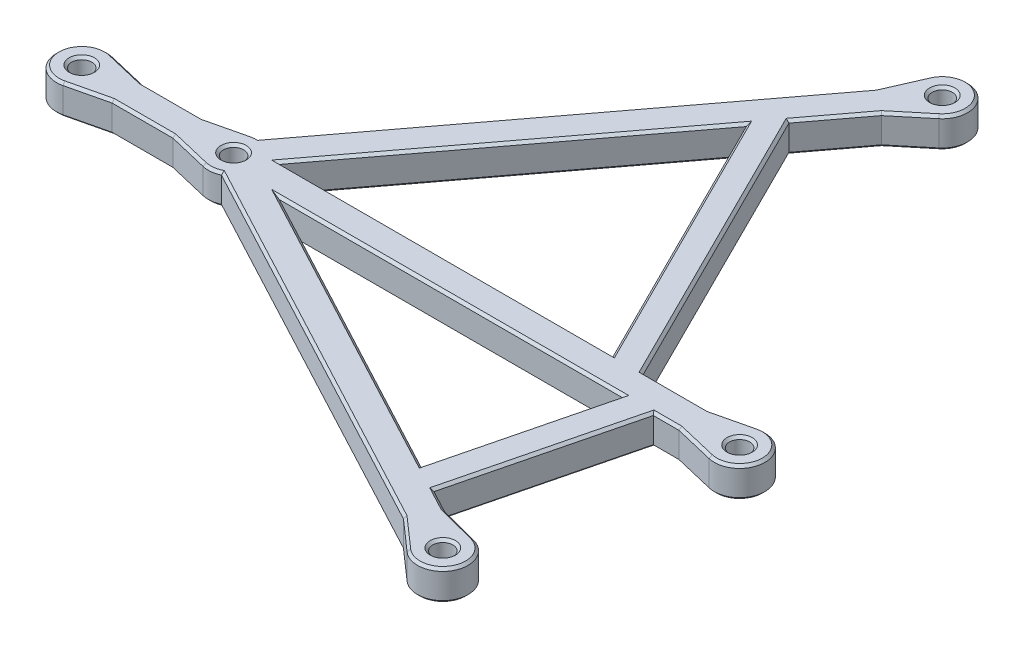
from build123d import *

# Parameters (mm, degrees)
SKETCH_1_R      = 1
EXTRUDE_2_DEPTH = 3
SKETCH_3_R      = 1
EXTRUDE_3_DEPTH = 3
EXTRUDE_4_DEPTH = 3
EXTRUDE_5_DEPTH = 3
EXTRUDE_6_DEPTH = 3
CHAMFER_1_SIZE  = 0.25


with BuildPart() as part:
    # 草图1 → 凸台-拉伸2 (new body)
    with BuildSketch(Plane(origin=(0, 0, 0), x_dir=(1, 0, 0), z_dir=(0, 1, 0))):
        with BuildLine():
            Line((2, 1.5), (13, 1.5))
            ThreePointArc((13, 1.5), (15, 2.5), (17, 1.5))
            Line((17, 1.5), (63, 1.5))
            ThreePointArc((63, 1.5), (67.5, 0), (63, -1.5))
            Line((63, -1.5), (17, -1.5))
            ThreePointArc((17, -1.5), (15, -2.5), (13, -1.5))
            Line((13, -1.5), (2, -1.5))
            ThreePointArc((2, -1.5), (-2.5, 0), (2, 1.5))
        make_face()
        with Locations(Location((0, 0, 0), (0, 0, 270))):
            Circle(SKETCH_1_R, mode=Mode.SUBTRACT)
        with Locations(Location((15, 0, 0), (0, 0, 270))):
            Circle(SKETCH_1_R, mode=Mode.SUBTRACT)
        with Locations(Location((65, 0, 0), (0, 0, 270))):
            Circle(SKETCH_1_R, mode=Mode.SUBTRACT)
    extrude(amount=EXTRUDE_2_DEPTH)

    # 草图3 → 凸台-拉伸3 (add)
    with BuildSketch(Plane(origin=(0, 0, 0), x_dir=(1, 0, 0), z_dir=(0, 1, 0))):
        with BuildLine():
            Line((15.005676781, 2.499993555), (42.689167846, 39.237227017))
            ThreePointArc((42.689167846, 39.237227017), (46.595288715, 41.928364277), (45.085074376, 37.431781948))
            Line((45.085074376, 37.431781948), (17.401583311, 0.694548485))
            ThreePointArc((17.401583311, 0.694548485), (17.440740018, 0.541099035), (17.47010253, 0.385478264))
            Line((17.47010253, 0.385478264), (58.085691801, -21.210213624))
            ThreePointArc((58.085691801, -21.210213624), (61.354748625, -24.647257046), (56.677277113, -23.859056403))
            Line((56.677277113, -23.859056403), (16.061687842, -2.263364515))
            ThreePointArc((16.061687842, -2.263364515), (12.559259982, -0.541099035), (15.005676781, 2.499993555))
        make_face()
        with Locations(Location((59.147379643, -23.473578139, 0), (0, 0, 270))):
            Circle(SKETCH_3_R, mode=Mode.SUBTRACT)
        with Locations(Location((45.090751158, 39.931775502, 0), (0, 0, 270))):
            Circle(SKETCH_3_R, mode=Mode.SUBTRACT)
        with Locations(Location((15, 0, 0), (0, 0, 270))):
            Circle(SKETCH_3_R, mode=Mode.SUBTRACT)
    extrude(amount=EXTRUDE_3_DEPTH)

    # 草图5 → 凸台-拉伸4 (add)
    with BuildSketch(Plane(origin=(0, 0, 0), x_dir=(1, 0, 0), z_dir=(0, 1, 0))):
        Polygon((50.968736425, 1.5), (37.844479209, 27.823187626), (39.651372694, 30.221016268), (53.97114317, 1.5), align=None)
    extrude(amount=EXTRUDE_4_DEPTH)

    # 草图6 → 凸台-拉伸5 (add)
    with BuildSketch(Plane(origin=(0, 0, 0), x_dir=(1, 0, 0), z_dir=(0, 1, 0))):
        Polygon((54.971865105, -1.5), (50.997269421, -17.441232589), (53.647846432, -18.850569385), (57.973829245, -1.5), align=None)
    extrude(amount=EXTRUDE_5_DEPTH)

    # 草图7 → 凸台-拉伸6 (add)
    with BuildSketch(Plane(origin=(0, 0, 0), x_dir=(1, 0, 0), z_dir=(0, 1, 0))):
        with BuildLine():
            Line((4.5, 1.5), (0.578145188, 2.432231104))
            ThreePointArc((0.578145188, 2.432231104), (1.370755945, 2.090700395), (2, 1.5))
            Line((2, 1.5), (4.5, 1.5))
        make_face()
        with BuildLine():
            Line((4.5, -1.5), (0.578145188, -2.432231104))
            ThreePointArc((0.578145188, -2.432231104), (1.370755945, -2.090700395), (2, -1.5))
            Line((2, -1.5), (4.5, -1.5))
        make_face()
        with BuildLine():
            Line((10.5, 1.5), (14.421854812, 2.432231104))
            ThreePointArc((14.421854812, 2.432231104), (13.629244055, 2.090700395), (13, 1.5))
            Line((13, 1.5), (10.5, 1.5))
        make_face()
        with BuildLine():
            Line((10.5, -1.5), (14.421854812, -2.432231104))
            ThreePointArc((14.421854812, -2.432231104), (13.629244055, -2.090700395), (13, -1.5))
            Line((13, -1.5), (10.5, -1.5))
        make_face()
        with BuildLine():
            Line((41.184630288, 37.240638242), (42.80034857, 40.933801444))
            ThreePointArc((42.80034857, 40.933801444), (42.596102061, 40.095256036), (42.689167846, 39.237227017))
            Line((42.689167846, 39.237227017), (41.184630288, 37.240638242))
        make_face()
        with BuildLine():
            Line((43.580536818, 35.435193172), (46.685280826, 38.006295008))
            ThreePointArc((46.685280826, 38.006295008), (45.935517213, 37.578826223), (45.085074376, 37.431781948))
            Line((45.085074376, 37.431781948), (43.580536818, 35.435193172))
        make_face()
        with BuildLine():
            Line((60.5, -1.5), (64.421854812, -2.432231104))
            ThreePointArc((64.421854812, -2.432231104), (63.629244055, -2.090700395), (63, -1.5))
            Line((63, -1.5), (60.5, -1.5))
        make_face()
        with BuildLine():
            Line((60.5, 1.5), (64.421854812, 2.432231104))
            ThreePointArc((64.421854812, 2.432231104), (63.629244055, 2.090700395), (63, 1.5))
            Line((63, 1.5), (60.5, 1.5))
        make_face()
        with BuildLine():
            Line((55.878322819, -20.036534717), (59.778771079, -21.054622816))
            ThreePointArc((59.778771079, -21.054622816), (58.918598363, -20.984068323), (58.085691801, -21.210213624))
            Line((58.085691801, -21.210213624), (55.878322819, -20.036534717))
        make_face()
        with BuildLine():
            Line((54.469908131, -22.685377496), (57.495044404, -25.349688013))
            ThreePointArc((57.495044404, -25.349688013), (56.9555496, -24.676026085), (56.677277113, -23.859056403))
            Line((56.677277113, -23.859056403), (54.469908131, -22.685377496))
        make_face()
    extrude(amount=EXTRUDE_6_DEPTH)

    # 倒角1
    chamfer_1_edges = [part.edges().sort_by_distance(p)[0] for p in [
        (57.235571585, 0, -1.5),
        (57.235571585, 3, -1.5),
        (62.460927406, 0, -1.966115552),
        (62.460927406, 3, -1.966115552),
        (46.595288715, 3, -41.928364277),
        (46.595288715, 0, -41.928364277),
        (45.132908822, 0, -36.72074409),
        (45.132908822, 3, -36.72074409),
        (-2.5, 0, 0),
        (-2.5, 3, 0),
        (2.539072594, 0, -1.966115552),
        (2.539072594, 3, -1.966115552),
        (28.095153535, 3, -19.870315898),
        (28.095153535, 0, -19.870315898),
        (41.992489429, 0, -39.087219843),
        (41.992489429, 3, -39.087219843),
        (7.5, 0, 1.5),
        (7.5, 3, 1.5),
        (2.539072594, 0, 1.966115552),
        (2.539072594, 3, 1.966115552),
        (7.5, 0, -1.5),
        (7.5, 3, -1.5),
        (12.460927406, 0, -1.966115552),
        (12.460927406, 3, -1.966115552),
        (15.256090523, 0, 2.486848939),
        (15.256090523, 3, 2.486848939),
        (12.460927406, 0, 1.966115552),
        (12.460927406, 3, 1.966115552),
        (61.354748625, 3, 24.647257046),
        (61.354748625, 0, 24.647257046),
        (55.982476267, 0, 24.017532754),
        (55.982476267, 3, 24.017532754),
        (54.763084626, 0, 19.443552051),
        (54.763084626, 3, 19.443552051),
        (57.828546949, 0, 20.545578767),
        (57.828546949, 3, 20.545578767),
        (67.5, 0, 0),
        (67.5, 3, 0),
        (62.460927406, 0, 1.966115552),
        (62.460927406, 3, 1.966115552),
        (0, 0, -1),
        (0, 3, -1),
        (15, 0, -1),
        (15, 3, -1),
        (65, 0, -1),
        (65, 3, -1),
        (14.71176753, 0, -2.483328823),
        (14.71176753, 3, -2.483328823),
        (37.994018253, 0, 1.5),
        (37.994018253, 3, 1.5),
        (27.926506886, 0, -14.661593813),
        (59.147379643, 0, 22.473578139),
        (45.090751158, 0, -40.931775502),
        (35.265797986, 3, 12.474371005),
        (27.926506886, 3, -14.661593813),
        (45.090751158, 3, -40.931775502),
        (59.147379643, 3, 22.473578139),
        (35.265797986, 0, 12.474371005),
        (41.615954756, 3, -32.82810472),
        (41.615954756, 0, -32.82810472),
        (34.488635494, 0, -1.5),
        (34.488635494, 3, -1.5),
        (46.811257932, 0, -15.860508134),
        (44.406607817, 0, -14.661593813),
        (44.406607817, 3, -14.661593813),
        (46.811257932, 3, -15.860508134),
        (36.006720411, 0, 9.470616295),
        (36.006720411, 3, 9.470616295),
        (59.236914623, 0, 1.5),
        (59.236914623, 3, 1.5),
        (55.810837839, 0, 10.175284693),
        (52.984567263, 0, 9.470616295),
        (52.984567263, 3, 9.470616295),
        (55.810837839, 3, 10.175284693),
    ]]
    chamfer(chamfer_1_edges, length=CHAMFER_1_SIZE)


solid = part.part
